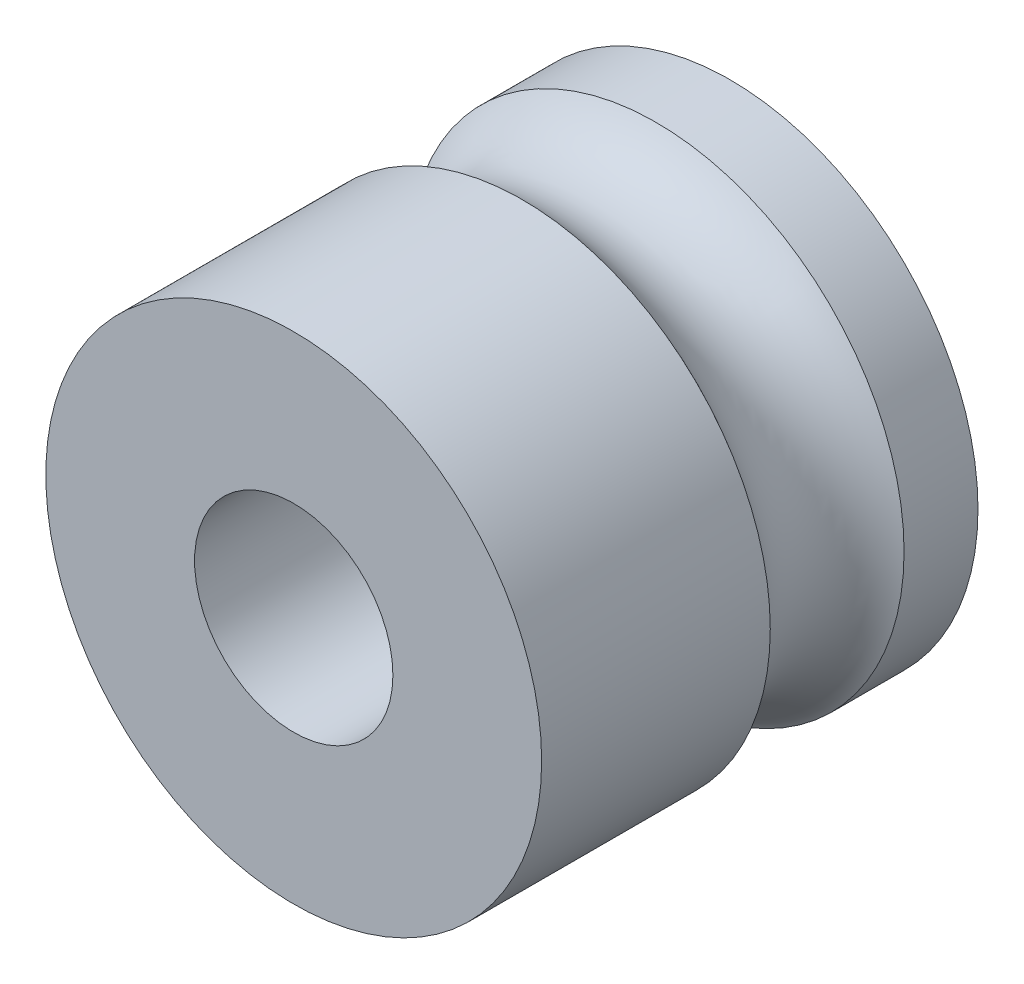
from build123d import *


with BuildPart() as part:
    # Sketch1 → Revolve1 (revolve)
    with BuildSketch(Plane(origin=(0, 0, 0), x_dir=(1, 0, 0), z_dir=(0, 1, 0))):
        with BuildLine():
            Line((6.25, -1.863472502), (6.25, 0))
            Line((6.25, 0), (2.5, 0))
            Line((2.5, 0), (2.5, -11))
            Line((2.5, -11), (6.25, -11))
            Line((6.25, -11), (6.25, -5.236527498))
            ThreePointArc((6.25, -5.236527498), (5.325, -3.55), (6.25, -1.863472502))
        make_face()
    revolve(axis=Axis((0, 0, 0), (0, 0, 1)))


solid = part.part
